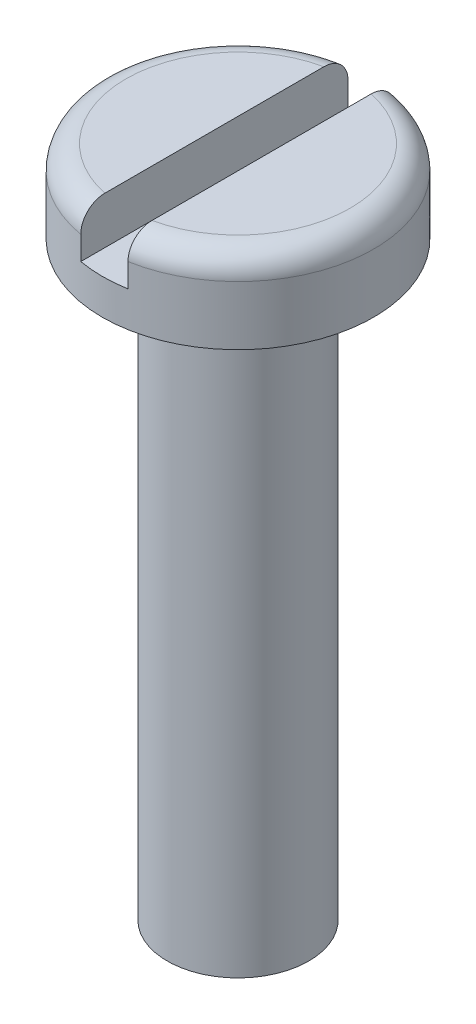
from build123d import *

# Parameters (mm, degrees)
SKETCH1_R           = 5.75
BOSS_EXTRUDE1_DEPTH = 3.5
SKETCH2_R           = 3
BOSS_EXTRUDE2_DEPTH = 25
FILLET1_R           = 1
SKETCH3_W           = 2
SKETCH3_H           = 13.136857928
CUT_EXTRUDE1_DEPTH  = 2


with BuildPart() as part:
    # Sketch1 → Boss-Extrude1 (new body)
    with BuildSketch(Plane(origin=(0, 0, 0), x_dir=(1, 0, 0), z_dir=(0, 1, 0))):
        with Locations(Location((0, 0, 0), (0, 0, 270))):
            Circle(SKETCH1_R)
    extrude(amount=BOSS_EXTRUDE1_DEPTH)

    # Sketch2 → Boss-Extrude2 (add)
    with BuildSketch(Plane.XZ):
        with Locations(Location((0, 0, 0), (0, 0, 270))):
            Circle(SKETCH2_R)
    extrude(amount=BOSS_EXTRUDE2_DEPTH)

    # Fillet1
    fillet1_edges = [part.edges().sort_by_distance(p)[0] for p in [
        (0, 3.5, -5.75),
    ]]
    fillet(fillet1_edges, radius=FILLET1_R)

    # Sketch3 → Cut-Extrude1 (cut)
    with BuildSketch(Plane(origin=(0, 3.5, 0), x_dir=(1, 0, 0), z_dir=(0, 1, 0))):
        Rectangle(SKETCH3_W, SKETCH3_H)
    extrude(amount=-CUT_EXTRUDE1_DEPTH, mode=Mode.SUBTRACT)


solid = part.part
